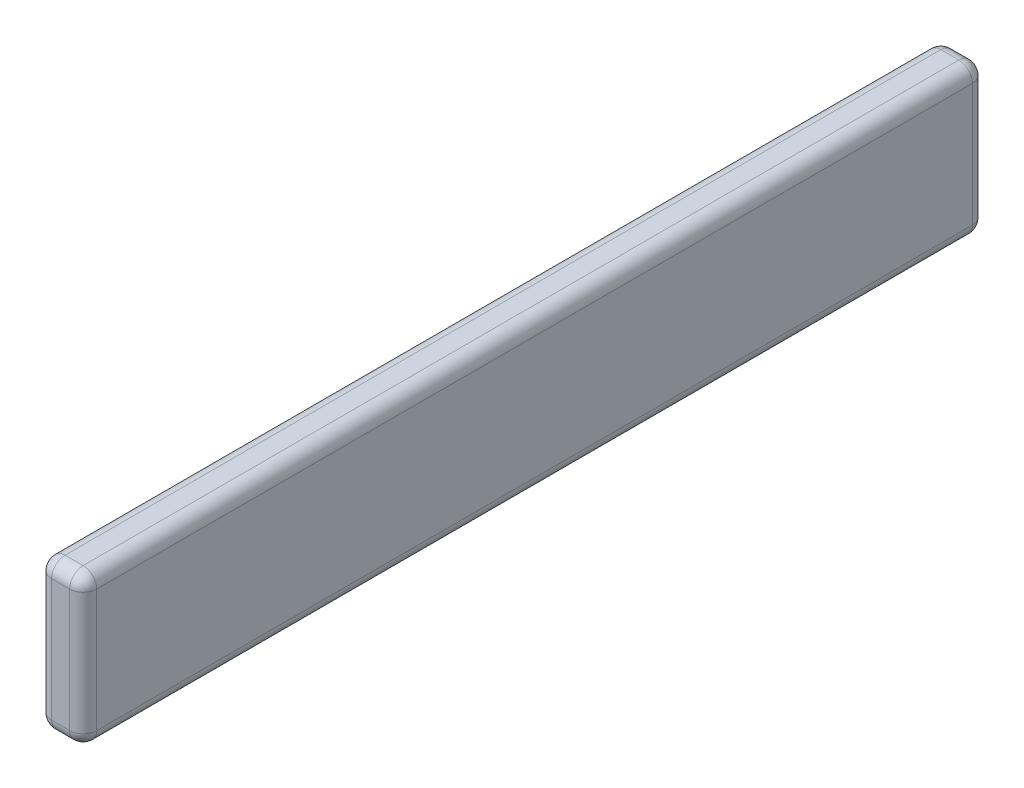
from build123d import *

# Parameters (mm, degrees)
SKETCH1_W           = 2000
SKETCH1_H           = 331.6
BOSS_EXTRUDE1_DEPTH = 100
FILLET1_R           = 30


with BuildPart() as part:
    # Sketch1 → Boss-Extrude1 (new body)
    with BuildSketch(Plane(origin=(0, 0, 0), x_dir=(0, 0, -1), z_dir=(1, 0, 0))):
        Rectangle(SKETCH1_W, SKETCH1_H)
    extrude(amount=BOSS_EXTRUDE1_DEPTH)

    # Fillet1
    fillet1_edges = [part.edges().sort_by_distance(p)[0] for p in [
        (100, 0, -1000),
        (100, 165.8, 0),
        (100, 0, 1000),
        (0, 165.8, 0),
        (0, 0, -1000),
        (0, -165.8, 0),
        (0, 0, 1000),
        (50, 165.8, 1000),
        (50, 165.8, -1000),
        (50, -165.8, -1000),
        (50, -165.8, 1000),
        (100, -165.8, 0),
    ]]
    fillet(fillet1_edges, radius=FILLET1_R)


solid = part.part
